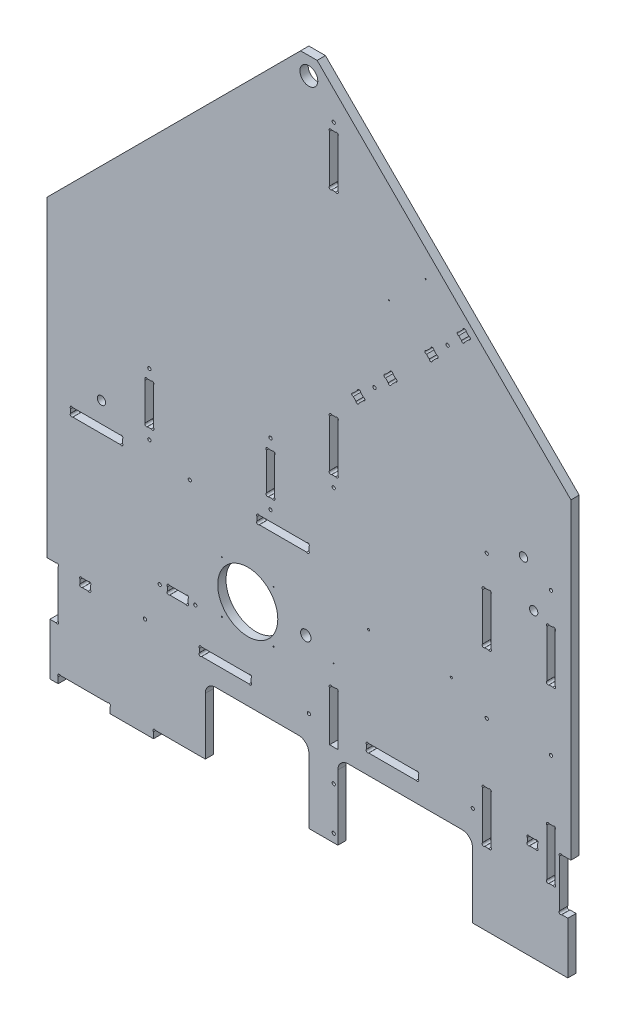
from build123d import *

# Parameters (mm, degrees)
ESQUISSE2_R             = 1.55
ESQUISSE2_R_2           = 4
BOSS_EXTRU_1_DEPTH      = 8
ESQUISSE3_R             = 0.5
ESQUISSE3_R_2           = 0.999999999
ESQUISSE3_R_3           = 1.55
ESQUISSE3_R_4           = 29
ESQUISSE3_R_5           = 5
ESQUISSE3_R_6           = 8.625
ESQUISSE3_R_7           = 4
ENL_V_MAT_EXTRU_1_DEPTH = 8


with BuildPart() as part:
    # Esquisse2 → Boss.-Extru.1 (new body)
    with BuildSketch(Plane.XY):
        with BuildLine():
            Line((-242, -23.417779528), (258, -23.417779528))
            Line((258, -23.417779528), (258, 26.582220472))
            Line((258, 26.582220472), (252.121320344, 26.582220472))
            ThreePointArc((252.121320344, 26.582220472), (250, 26.582220472), (250, 28.703540816))
            Line((250, 28.703540816), (250, 74.460900128))
            ThreePointArc((250, 74.460900128), (250, 76.582220472), (252.121320344, 76.582220472))
            Line((252.121320344, 76.582220472), (258, 76.582220472))
            Line((258, 76.582220472), (261, 76.582220472))
            Line((261, 76.582220472), (261, 377.824861159))
            Line((261, 377.824861159), (8, 630.824861159))
            Line((8, 630.824861159), (-245, 377.824861159))
            Line((-245, 377.824861159), (-245, 76.582220472))
            Line((-245, 76.582220472), (-242, 76.582220472))
            Line((-242, 76.582220472), (-236.121320344, 76.582220472))
            ThreePointArc((-236.121320344, 76.582220472), (-234, 76.582220472), (-234, 74.460900128))
            Line((-234, 74.460900128), (-234, 28.703540816))
            ThreePointArc((-234, 28.703540816), (-234, 26.582220472), (-236.121320344, 26.582220472))
            Line((-236.121320344, 26.582220472), (-242, 26.582220472))
            Line((-242, 26.582220472), (-242, -23.417779528))
        make_face()
        with Locations((-29, 284.582220472)):
            Circle(ESQUISSE2_R, mode=Mode.SUBTRACT)
        with Locations((-29, 224.582220472)):
            Circle(ESQUISSE2_R, mode=Mode.SUBTRACT)
        with Locations((-146, 284.082220472)):
            Circle(ESQUISSE2_R, mode=Mode.SUBTRACT)
        with Locations((-146, 224.582220472)):
            Circle(ESQUISSE2_R, mode=Mode.SUBTRACT)
        with Locations((-101.615900069, 108.582220472)):
            Circle(ESQUISSE2_R, mode=Mode.SUBTRACT)
        with Locations((-136, 108.582220472)):
            Circle(ESQUISSE2_R, mode=Mode.SUBTRACT)
        with Locations((225.079264135, 267.282220472)):
            Circle(ESQUISSE2_R_2, mode=Mode.SUBTRACT)
        with Locations((142.004667301, 447.654384248)):
            Circle(ESQUISSE2_R, mode=Mode.SUBTRACT)
        with Locations((71.293989183, 376.943706129)):
            Circle(ESQUISSE2_R, mode=Mode.SUBTRACT)
        with Locations((241.730741866, 154.582220472)):
            Circle(ESQUISSE2_R, mode=Mode.SUBTRACT)
        with Locations((179.730741866, 154.582220472)):
            Circle(ESQUISSE2_R, mode=Mode.SUBTRACT)
        with BuildLine():
            Line((-147.878679656, 274.582220472), (-144.121320344, 274.582220472))
            ThreePointArc((-144.121320344, 274.582220472), (-142, 274.582220472), (-142, 272.460900128))
            Line((-142, 272.460900128), (-142, 236.703540816))
            ThreePointArc((-142, 236.703540816), (-142, 234.582220472), (-144.121320344, 234.582220472))
            Line((-144.121320344, 234.582220472), (-147.878679656, 234.582220472))
            ThreePointArc((-147.878679656, 234.582220472), (-150, 234.582220472), (-150, 236.703540816))
            Line((-150, 236.703540816), (-150, 272.460900128))
            ThreePointArc((-150, 272.460900128), (-150, 274.582220472), (-147.878679656, 274.582220472))
        make_face(mode=Mode.SUBTRACT)
        with BuildLine():
            Line((-27.121320344, 274.582220472), (-30.878679656, 274.582220472))
            ThreePointArc((-30.878679656, 274.582220472), (-33, 274.582220472), (-33, 272.460900128))
            Line((-33, 272.460900128), (-33, 236.703540816))
            ThreePointArc((-33, 236.703540816), (-33, 234.582220472), (-30.878679656, 234.582220472))
            Line((-30.878679656, 234.582220472), (-27.121320344, 234.582220472))
            ThreePointArc((-27.121320344, 234.582220472), (-25, 234.582220472), (-25, 236.703540816))
            Line((-25, 236.703540816), (-25, 272.460900128))
            ThreePointArc((-25, 272.460900128), (-25, 274.582220472), (-27.121320344, 274.582220472))
        make_face(mode=Mode.SUBTRACT)
    extrude(amount=BOSS_EXTRU_1_DEPTH)

    # Esquisse3 → Enlèv. mat.-Extru.1 (cut)
    with BuildSketch(Plane.XY.offset(8)):
        with Locations((120.814971155, 492.225618752)):
            Circle(ESQUISSE3_R)
        with Locations((85.459632096, 456.870279693)):
            Circle(ESQUISSE3_R)
        with Locations((65.480741866, 171.582220474)):
            Circle(ESQUISSE3_R_2)
        with Locations((179.730741866, 292.582220472)):
            Circle(ESQUISSE3_R_3)
        with Locations(Location((241.730741866, 292.582220472, 0), (0, 0, 180))):
            Circle(ESQUISSE3_R_3)
        with Locations((32, 126.582220472)):
            Circle(ESQUISSE3_R)
        with Locations((32, 579.082220472)):
            Circle(ESQUISSE3_R_3)
        with Locations((32, 25.997891439)):
            Circle(ESQUISSE3_R_3)
        with Locations((32, -15.417779528)):
            Circle(ESQUISSE3_R_3)
        with Locations((-51, 136.582220472)):
            Circle(ESQUISSE3_R_4)
        with Locations((-76, 161.582220472)):
            Circle(ESQUISSE3_R)
        with Locations(Location((-26, 161.582220472, 0), (0, 0, 180))):
            Circle(ESQUISSE3_R)
        with Locations((-26, 111.582220472)):
            Circle(ESQUISSE3_R)
        with Locations(Location((-76, 111.582220472, 0), (0, 0, 180))):
            Circle(ESQUISSE3_R)
        with Locations((5, 136.582220472)):
            Circle(ESQUISSE3_R_5)
        with Locations((8, 605.824861159)):
            Circle(ESQUISSE3_R_6)
        with Locations((215.231781866, 307.260350698)):
            Circle(ESQUISSE3_R_7)
        with Locations((-107, 210.582220472)):
            Circle(ESQUISSE3_R_3)
        with Locations((32, 273.510913228)):
            Circle(ESQUISSE3_R_3)
        with Locations((8, 72.582220472)):
            Circle(ESQUISSE3_R_3)
        with Locations((-150.258470568, 72.582220472)):
            Circle(ESQUISSE3_R_3)
        with Locations((-192.25, 234.38230674)):
            Circle(ESQUISSE3_R_7)
        with Locations((145.480741866, 171.582220474)):
            Circle(ESQUISSE3_R_2)
        with Locations(Location((166.258470568, 72.582220472, 0), (0, 0, 180))):
            Circle(ESQUISSE3_R_3)
        with BuildLine():
            Line((124.241211334, 427.234074031), (121.584357084, 429.89092828))
            ThreePointArc((121.584357084, 429.89092828), (120.084357084, 431.39092828), (121.584357084, 432.89092828))
            Line((121.584357084, 432.89092828), (125.655424896, 436.961996092))
            ThreePointArc((125.655424896, 436.961996092), (127.155424896, 438.461996092), (128.655424896, 436.961996092))
            Line((128.655424896, 436.961996092), (131.312279146, 434.305141843))
            ThreePointArc((131.312279146, 434.305141843), (132.812279146, 432.805141843), (131.312279146, 431.305141843))
            Line((131.312279146, 431.305141843), (127.241211334, 427.234074031))
            ThreePointArc((127.241211334, 427.234074031), (125.741211334, 425.734074031), (124.241211334, 427.234074031))
        make_face()
        with BuildLine():
            Line((162.424977518, 462.417840215), (158.353909706, 458.346772403))
            ThreePointArc((158.353909706, 458.346772403), (156.853909706, 456.846772403), (155.353909706, 458.346772403))
            Line((155.353909706, 458.346772403), (152.697055457, 461.003626652))
            ThreePointArc((152.697055457, 461.003626652), (151.197055457, 462.503626652), (152.697055457, 464.003626652))
            Line((152.697055457, 464.003626652), (156.768123268, 468.074694464))
            ThreePointArc((156.768123268, 468.074694464), (158.268123268, 469.574694464), (159.768123268, 468.074694464))
            Line((159.768123268, 468.074694464), (162.424977518, 465.417840215))
            ThreePointArc((162.424977518, 465.417840215), (163.924977518, 463.917840215), (162.424977518, 462.417840215))
        make_face()
        with BuildLine():
            Line((56.530533215, 356.523395912), (60.601601027, 360.594463724))
            ThreePointArc((60.601601027, 360.594463724), (62.101601027, 362.094463724), (60.601601027, 363.594463724))
            Line((60.601601027, 363.594463724), (57.944746778, 366.251317973))
            ThreePointArc((57.944746778, 366.251317973), (56.444746778, 367.751317973), (54.944746778, 366.251317974))
            Line((54.944746778, 366.251317974), (50.873678966, 362.180250162))
            ThreePointArc((50.873678966, 362.180250162), (49.373678966, 360.680250162), (50.873678966, 359.180250162))
            Line((50.873678966, 359.180250162), (53.530533215, 356.523395912))
            ThreePointArc((53.530533215, 356.523395912), (55.030533215, 355.023395912), (56.530533215, 356.523395912))
        make_face()
        with BuildLine():
            Line((84.643231588, 387.636094284), (81.986377338, 390.292948534))
            ThreePointArc((81.986377338, 390.292948534), (80.486377338, 391.792948534), (81.986377338, 393.292948534))
            Line((81.986377338, 393.292948534), (86.05744515, 397.364016346))
            ThreePointArc((86.05744515, 397.364016346), (87.55744515, 398.864016346), (89.05744515, 397.364016346))
            Line((89.05744515, 397.364016346), (91.714299399, 394.707162096))
            ThreePointArc((91.714299399, 394.707162096), (93.214299399, 393.207162096), (91.714299399, 391.707162096))
            Line((91.714299399, 391.707162096), (87.643231587, 387.636094284))
            ThreePointArc((87.643231587, 387.636094284), (86.143231587, 386.136094284), (84.643231588, 387.636094284))
        make_face()
        Polygon((0, 622.824861159), (16, 622.824861159), (8, 630.824861159), align=None)
        with BuildLine():
            Line((36, -23.417779528), (36, 39.582220472))
            ThreePointArc((36, 39.582220472), (38.928932188, 46.653288284), (46, 49.582220472))
            Line((46, 49.582220472), (156, 49.582220472))
            ThreePointArc((156, 49.582220472), (163.071067812, 46.653288284), (166, 39.582220472))
            Line((166, 39.582220472), (166, -23.417779528))
            Line((166, -23.417779528), (36, -23.417779528))
        make_face()
        with BuildLine():
            Line((8, -23.417779528), (8, 39.582220472))
            ThreePointArc((8, 39.582220472), (5.071067812, 46.653288284), (-2, 49.582220472))
            Line((-2, 49.582220472), (-82, 49.582220472))
            ThreePointArc((-82, 49.582220472), (-89.071067812, 46.653288284), (-92, 39.582220472))
            Line((-92, 39.582220472), (-92, -15.417779528))
            Line((-92, -15.417779528), (-139.878679656, -15.417779528))
            ThreePointArc((-139.878679656, -15.417779528), (-142, -15.417779528), (-142, -17.539099872))
            Line((-142, -17.539099872), (-142, -23.417779528))
            Line((-142, -23.417779528), (-92, -23.417779528))
            Line((-92, -23.417779528), (8, -23.417779528))
        make_face()
        with BuildLine():
            Line((28, 56.582220472), (36, 56.582220472))
            Line((36, 56.582220472), (36, 104.460900128))
            ThreePointArc((36, 104.460900128), (35.917635531, 106.664584941), (33.713950719, 106.582220472))
            Line((33.713950719, 106.582220472), (30.121320344, 106.582220472))
            ThreePointArc((30.121320344, 106.582220472), (28, 106.582220472), (28, 104.460900128))
            Line((28, 104.460900128), (28, 56.582220472))
        make_face()
        with BuildLine():
            Line((30.121320344, 521.582220472), (33.878679656, 521.582220472))
            ThreePointArc((33.878679656, 521.582220472), (36, 521.582220472), (36, 523.703540816))
            Line((36, 523.703540816), (36, 569.460900128))
            ThreePointArc((36, 569.460900128), (36, 571.582220472), (33.878679656, 571.582220472))
            Line((33.878679656, 571.582220472), (30.121320344, 571.582220472))
            ThreePointArc((30.121320344, 571.582220472), (28, 571.582220472), (28, 569.460900128))
            Line((28, 569.460900128), (28, 523.703540816))
            ThreePointArc((28, 523.703540816), (28, 521.582220472), (30.121320344, 521.582220472))
        make_face()
        with BuildLine():
            Line((30.121320344, 283.582220472), (33.878679656, 283.582220472))
            ThreePointArc((33.878679656, 283.582220472), (36, 283.582220472), (36, 285.703540816))
            Line((36, 285.703540816), (36, 331.460900128))
            ThreePointArc((36, 331.460900128), (36, 333.582220472), (33.878679656, 333.582220472))
            Line((33.878679656, 333.582220472), (30.121320344, 333.582220472))
            ThreePointArc((30.121320344, 333.582220472), (28, 333.582220472), (28, 331.460900128))
            Line((28, 331.460900128), (28, 285.703540816))
            ThreePointArc((28, 285.703540816), (28, 283.582220472), (30.121320344, 283.582220472))
        make_face()
        with BuildLine():
            Line((243.609421523, 212.582220472), (239.85206221, 212.582220472))
            ThreePointArc((239.85206221, 212.582220472), (237.730741866, 212.582220472), (237.730741866, 214.703540816))
            Line((237.730741866, 214.703540816), (237.730741866, 260.460900128))
            ThreePointArc((237.730741866, 260.460900128), (237.730741866, 262.582220471), (239.85206221, 262.582220471))
            Line((239.85206221, 262.582220471), (243.302363451, 262.582220471))
            ThreePointArc((243.302363451, 262.582220471), (245.730741866, 262.582220471), (245.730741866, 260.153842056))
            Line((245.730741866, 260.153842056), (245.730741866, 214.703540816))
            ThreePointArc((245.730741866, 214.703540816), (245.730741866, 212.582220472), (243.609421523, 212.582220472))
        make_face()
        with BuildLine():
            Line((220.972064578, 76.582220472), (226.729423891, 76.582220472))
            ThreePointArc((226.729423891, 76.582220472), (228.850744234, 76.582220472), (228.850744234, 74.460900128))
            Line((228.850744234, 74.460900128), (228.850744234, 70.703540816))
            ThreePointArc((228.850744234, 70.703540816), (228.850744234, 68.582220472), (226.729423891, 68.582220472))
            Line((226.729423891, 68.582220472), (220.972064578, 68.582220472))
            ThreePointArc((220.972064578, 68.582220472), (218.850744235, 68.582220472), (218.850744235, 70.703540816))
            Line((218.850744235, 70.703540816), (218.850744235, 74.460900128))
            ThreePointArc((218.850744235, 74.460900128), (218.850744234, 76.582220472), (220.972064578, 76.582220472))
        make_face()
        with BuildLine():
            Line((181.609421523, 212.582220472), (177.85206221, 212.582220472))
            ThreePointArc((177.85206221, 212.582220472), (175.730741866, 212.582220472), (175.730741866, 214.703540816))
            Line((175.730741866, 214.703540816), (175.730741866, 260.153842056))
            ThreePointArc((175.730741866, 260.153842056), (175.730741866, 262.582220471), (178.159120281, 262.582220471))
            Line((178.159120281, 262.582220471), (181.609421523, 262.582220471))
            ThreePointArc((181.609421523, 262.582220471), (183.730741866, 262.582220471), (183.730741866, 260.460900128))
            Line((183.730741866, 260.460900128), (183.730741866, 214.703540816))
            ThreePointArc((183.730741866, 214.703540816), (183.730741866, 212.582220472), (181.609421523, 212.582220472))
        make_face()
        with BuildLine():
            Line((-222, 212.460900128), (-222, 208.703540816))
            ThreePointArc((-222, 208.703540816), (-222, 206.582220472), (-219.878679656, 206.582220472))
            Line((-219.878679656, 206.582220472), (-174.121320344, 206.582220472))
            ThreePointArc((-174.121320344, 206.582220472), (-172, 206.582220472), (-172, 208.703540816))
            Line((-172, 208.703540816), (-172, 212.460900128))
            ThreePointArc((-172, 212.460900128), (-172, 214.582220472), (-174.121320344, 214.582220472))
            Line((-174.121320344, 214.582220472), (-219.878679656, 214.582220472))
            ThreePointArc((-219.878679656, 214.582220472), (-222, 214.582220472), (-222, 212.460900128))
        make_face()
        with BuildLine():
            Line((8, 212.460900128), (8, 208.703540816))
            ThreePointArc((8, 208.703540816), (8, 206.582220472), (5.878679656, 206.582220472))
            Line((5.878679656, 206.582220472), (-39.878679656, 206.582220472))
            ThreePointArc((-39.878679656, 206.582220472), (-42, 206.582220472), (-42, 208.703540816))
            Line((-42, 208.703540816), (-42, 212.460900128))
            ThreePointArc((-42, 212.460900128), (-42, 214.582220472), (-39.878679656, 214.582220472))
            Line((-39.878679656, 214.582220472), (5.878679657, 214.582220472))
            ThreePointArc((5.878679657, 214.582220472), (8, 214.582220472), (8, 212.460900128))
        make_face()
        with BuildLine():
            Line((-234, -23.417779528), (-234, -17.539099872))
            ThreePointArc((-234, -17.539099872), (-234, -15.417779528), (-231.878679656, -15.417779528))
            Line((-231.878679656, -15.417779528), (-186.121320344, -15.417779528))
            ThreePointArc((-186.121320344, -15.417779528), (-184, -15.417779528), (-184, -17.539099872))
            Line((-184, -17.539099872), (-184, -23.417779528))
            Line((-184, -23.417779528), (-234, -23.417779528))
        make_face()
        with BuildLine():
            Line((65.787517246, 76.582220472), (111.544876559, 76.582220472))
            ThreePointArc((111.544876559, 76.582220472), (113.666196902, 76.582220472), (113.666196902, 74.460900128))
            Line((113.666196902, 74.460900128), (113.666196902, 70.703540815))
            ThreePointArc((113.666196902, 70.703540815), (113.666196902, 68.582220472), (111.544876559, 68.582220472))
            Line((111.544876559, 68.582220472), (65.787517246, 68.582220472))
            ThreePointArc((65.787517246, 68.582220472), (63.666196902, 68.582220472), (63.666196902, 70.703540816))
            Line((63.666196902, 70.703540816), (63.666196902, 74.460900128))
            ThreePointArc((63.666196902, 74.460900128), (63.666196902, 76.582220472), (65.787517246, 76.582220472))
        make_face()
        with BuildLine():
            Line((-47.666196902, 70.703540816), (-47.666196902, 74.460900128))
            ThreePointArc((-47.666196902, 74.460900128), (-47.666196902, 76.582220472), (-49.787517246, 76.582220472))
            Line((-49.787517246, 76.582220472), (-95.544876559, 76.582220472))
            ThreePointArc((-95.544876559, 76.582220472), (-97.666196902, 76.582220472), (-97.666196902, 74.460900128))
            Line((-97.666196902, 74.460900128), (-97.666196902, 70.703540815))
            ThreePointArc((-97.666196902, 70.703540815), (-97.666196902, 68.582220472), (-95.544876559, 68.582220472))
            Line((-95.544876559, 68.582220472), (-49.787517246, 68.582220472))
            ThreePointArc((-49.787517246, 68.582220472), (-47.666196902, 68.582220472), (-47.666196902, 70.703540816))
        make_face()
        with BuildLine():
            Line((-212.850744234, 74.460900128), (-212.850744234, 70.703540816))
            ThreePointArc((-212.850744234, 70.703540816), (-212.850744234, 68.582220472), (-210.729423891, 68.582220472))
            Line((-210.729423891, 68.582220472), (-204.972064578, 68.582220472))
            ThreePointArc((-204.972064578, 68.582220472), (-202.850744235, 68.582220472), (-202.850744235, 70.703540816))
            Line((-202.850744235, 70.703540816), (-202.850744235, 74.460900128))
            ThreePointArc((-202.850744235, 74.460900128), (-202.850744234, 76.582220472), (-204.972064578, 76.582220472))
            Line((-204.972064578, 76.582220472), (-210.729423891, 76.582220472))
            ThreePointArc((-210.729423891, 76.582220472), (-212.850744234, 76.582220472), (-212.850744234, 74.460900128))
        make_face()
        with BuildLine():
            Line((181.609421523, 46.582220472), (177.85206221, 46.582220472))
            ThreePointArc((177.85206221, 46.582220472), (175.730741866, 46.582220472), (175.730741866, 48.703540816))
            Line((175.730741866, 48.703540816), (175.730741866, 94.460900135))
            ThreePointArc((175.730741866, 94.460900135), (175.73074187, 96.582220475), (177.85206221, 96.582220472))
            Line((177.85206221, 96.582220472), (181.609421523, 96.582220472))
            ThreePointArc((181.609421523, 96.582220472), (183.730741866, 96.582220472), (183.730741866, 94.460900128))
            Line((183.730741866, 94.460900128), (183.730741866, 48.703540816))
            ThreePointArc((183.730741866, 48.703540816), (183.730741866, 46.582220472), (181.609421523, 46.582220472))
        make_face()
        with BuildLine():
            Line((239.85206221, 96.582220472), (243.609421523, 96.582220472))
            ThreePointArc((243.609421523, 96.582220472), (245.730741863, 96.582220475), (245.730741866, 94.460900135))
            Line((245.730741866, 94.460900135), (245.730741866, 48.703540816))
            ThreePointArc((245.730741866, 48.703540816), (245.730741866, 46.582220472), (243.609421523, 46.582220472))
            Line((243.609421523, 46.582220472), (239.85206221, 46.582220472))
            ThreePointArc((239.85206221, 46.582220472), (237.730741866, 46.582220472), (237.730741866, 48.703540816))
            Line((237.730741866, 48.703540816), (237.730741866, 94.460900128))
            ThreePointArc((237.730741866, 94.460900128), (237.730741866, 96.582220472), (239.85206221, 96.582220472))
        make_face()
        with BuildLine():
            Line((-126.378679656, 112.582220472), (-110.621320344, 112.582220472))
            ThreePointArc((-110.621320344, 112.582220472), (-108.5, 112.582220472), (-108.5, 110.460900128))
            Line((-108.5, 110.460900128), (-108.5, 106.703540816))
            ThreePointArc((-108.5, 106.703540816), (-108.5, 104.582220472), (-110.621320344, 104.582220472))
            Line((-110.621320344, 104.582220472), (-126.378679656, 104.582220472))
            ThreePointArc((-126.378679656, 104.582220472), (-128.5, 104.582220472), (-128.5, 106.703540816))
            Line((-128.5, 106.703540816), (-128.5, 110.460900128))
            ThreePointArc((-128.5, 110.460900128), (-128.5, 112.582220472), (-126.378679656, 112.582220472))
        make_face()
    extrude(amount=-ENL_V_MAT_EXTRU_1_DEPTH, mode=Mode.SUBTRACT)


solid = part.part
